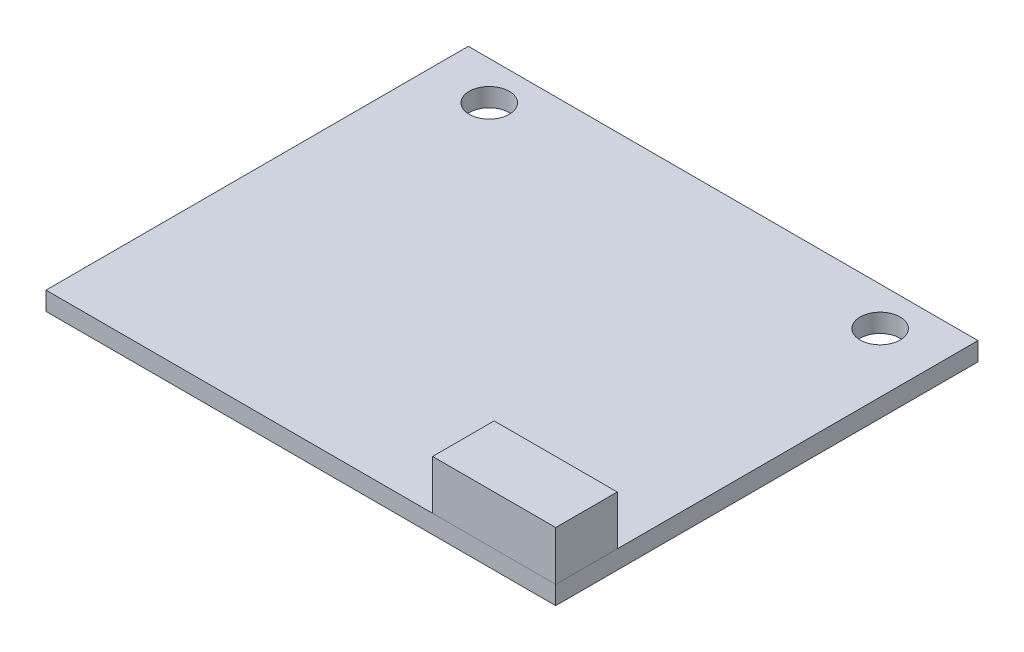
from build123d import *

# Parameters (mm, degrees)
SKICA1_W                = 41.4
SKICA1_H                = 34.3
SKICA1_R                = 1.625
P_IDAT_VYSUNUT_M1_DEPTH = 1.5
SKICA2_W                = 10
SKICA2_H                = 5
P_IDAT_VYSUNUT_M2_DEPTH = 4


with BuildPart() as part:
    # Skica1 → Přidat vysunutím1 (new body)
    with BuildSketch(Plane(origin=(0, 0, 0), x_dir=(1, 0, 0), z_dir=(0, 1, 0))):
        Rectangle(SKICA1_W, SKICA1_H)
        with Locations(Location((-15.875, 14.025, 0), (0, 0, 270))):
            Circle(SKICA1_R, mode=Mode.SUBTRACT)
        with Locations(Location((15.875, 14.025, 0), (0, 0, 270))):
            Circle(SKICA1_R, mode=Mode.SUBTRACT)
    extrude(amount=P_IDAT_VYSUNUT_M1_DEPTH)


with BuildPart() as body_2:
    # Skica2 → Přidat vysunutím2 (new body)
    with BuildSketch(Plane(origin=(0, 1.5, 0), x_dir=(1, 0, 0), z_dir=(0, 1, 0))):
        with Locations((15.7, -14.65)):
            Rectangle(SKICA2_W, SKICA2_H)
    extrude(amount=P_IDAT_VYSUNUT_M2_DEPTH)


solid = Compound([part.part, body_2.part])
